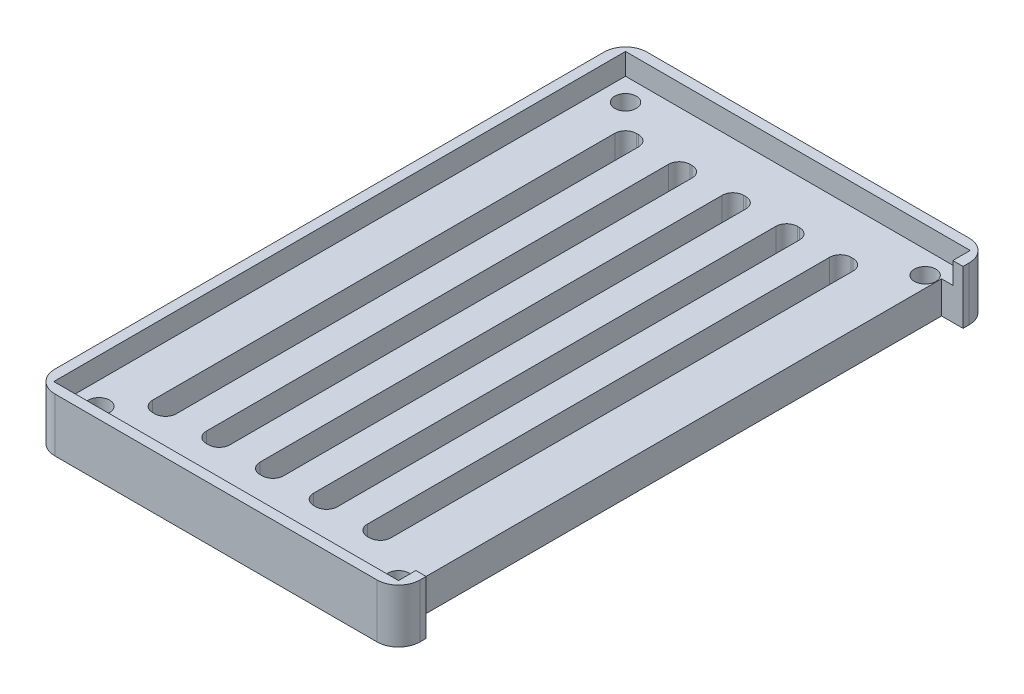
from build123d import *

# Parameters (mm, degrees)
SKETCH_1_W          = 34
SKETCH_1_H          = 55.14
EXTRUDE_1_DEPTH     = 5
SKETCH_2_W          = 32.1
SKETCH_2_H          = 53.24
CUT_EXTRUDE_1_DEPTH = 2
SKETCH_3_W          = 50
SKETCH_3_H          = 10
CUT_EXTRUDE_2_DEPTH = 2
FILLET_3_R          = 2
FILLET_4_R          = 2
FILLET_5_R          = 2
FILLET_6_R          = 2
SKETCH_5_R          = 1
CUT_EXTRUDE_3_DEPTH = 5
CUT_EXTRUDE_5_DEPTH = 5


with BuildPart() as part:
    # 草图1 → 凸台-拉伸1 (new body)
    with BuildSketch(Plane(origin=(0, 0, 0), x_dir=(1, 0, 0), z_dir=(0, 1, 0))):
        with Locations((17, 27.57)):
            Rectangle(SKETCH_1_W, SKETCH_1_H)
    extrude(amount=EXTRUDE_1_DEPTH)

    # 草图2 → 切除-拉伸1 (cut)
    with BuildSketch(Plane(origin=(0, 5, 0), x_dir=(1, 0, 0), z_dir=(0, 1, 0))):
        with Locations((17, 27.57)):
            Rectangle(SKETCH_2_W, SKETCH_2_H)
    extrude(amount=-CUT_EXTRUDE_1_DEPTH, mode=Mode.SUBTRACT)

    # 草图3 → 切除-拉伸2 (cut)
    with BuildSketch(Plane(origin=(34, 0, 0), x_dir=(0, 0, -1), z_dir=(1, 0, 0))):
        with Locations((27.57, 5)):
            Rectangle(SKETCH_3_W, SKETCH_3_H)
    extrude(amount=-CUT_EXTRUDE_2_DEPTH, mode=Mode.SUBTRACT)

    # 圆角3
    fillet_3_edges = [part.edges().sort_by_distance(p)[0] for p in [
        (0, 2.5, 0),
    ]]
    fillet(fillet_3_edges, radius=FILLET_3_R)

    # 圆角4
    fillet_4_edges = [part.edges().sort_by_distance(p)[0] for p in [
        (0, 2.5, -55.14),
    ]]
    fillet(fillet_4_edges, radius=FILLET_4_R)

    # 圆角5
    fillet_5_edges = [part.edges().sort_by_distance(p)[0] for p in [
        (34, 2.5, -55.14),
    ]]
    fillet(fillet_5_edges, radius=FILLET_5_R)

    # 圆角6
    fillet_6_edges = [part.edges().sort_by_distance(p)[0] for p in [
        (34, 2.5, 0),
    ]]
    fillet(fillet_6_edges, radius=FILLET_6_R)

    # 草图5 → 切除-拉伸3 (cut)
    with BuildSketch(Plane(origin=(0, 3, 0), x_dir=(1, 0, 0), z_dir=(0, 1, 0))):
        with Locations(Location((3.05, 52.09, 0), (0, 0, 270))):
            Circle(SKETCH_5_R)
        with Locations(Location((3.05, 3.05, 0), (0, 0, 90))):
            Circle(SKETCH_5_R)
        with Locations(Location((30.95, 3.05, 0), (0, 0, 270))):
            Circle(SKETCH_5_R)
        with Locations(Location((30.95, 52.09, 0), (0, 0, 90))):
            Circle(SKETCH_5_R)
    extrude(amount=-CUT_EXTRUDE_3_DEPTH, mode=Mode.SUBTRACT)

    # 草图6 → 切除-拉伸5 (cut)
    with BuildSketch(Plane(origin=(0, 3, 0), x_dir=(1, 0, 0), z_dir=(0, 1, 0))):
        with BuildLine():
            ThreePointArc((5.05, 49.09), (5.342893219, 49.797106781), (6.05, 50.09))
            Line((6.05, 50.09), (6.254717451, 50.09))
            ThreePointArc((6.254717451, 50.09), (6.961824232, 49.797106781), (7.254717451, 49.09))
            Line((7.254717451, 49.09), (7.254717451, 6.05))
            ThreePointArc((7.254717451, 6.05), (6.961824232, 5.342893219), (6.254717451, 5.05))
            Line((6.254717451, 5.05), (6.05, 5.05))
            ThreePointArc((6.05, 5.05), (5.342893219, 5.342893219), (5.05, 6.05))
            Line((5.05, 6.05), (5.05, 49.09))
        make_face()
        with BuildLine():
            ThreePointArc((10.05, 49.09), (10.342893219, 49.797106781), (11.05, 50.09))
            Line((11.05, 50.09), (11.254717451, 50.09))
            ThreePointArc((11.254717451, 50.09), (11.961824232, 49.797106781), (12.254717451, 49.09))
            Line((12.254717451, 49.09), (12.254717451, 6.05))
            ThreePointArc((12.254717451, 6.05), (11.961824232, 5.342893219), (11.254717451, 5.05))
            Line((11.254717451, 5.05), (11.05, 5.05))
            ThreePointArc((11.05, 5.05), (10.342893219, 5.342893219), (10.05, 6.05))
            Line((10.05, 6.05), (10.05, 49.09))
        make_face()
        with BuildLine():
            ThreePointArc((20.05, 49.09), (20.342893219, 49.797106781), (21.05, 50.09))
            Line((21.05, 50.09), (21.254717451, 50.09))
            ThreePointArc((21.254717451, 50.09), (21.961824232, 49.797106781), (22.254717451, 49.09))
            Line((22.254717451, 49.09), (22.254717451, 6.05))
            ThreePointArc((22.254717451, 6.05), (21.961824232, 5.342893219), (21.254717451, 5.05))
            Line((21.254717451, 5.05), (21.05, 5.05))
            ThreePointArc((21.05, 5.05), (20.342893219, 5.342893219), (20.05, 6.05))
            Line((20.05, 6.05), (20.05, 49.09))
        make_face()
        with BuildLine():
            ThreePointArc((26.05, 5.05), (25.342893219, 5.342893219), (25.05, 6.05))
            Line((25.05, 6.05), (25.05, 49.09))
            ThreePointArc((25.05, 49.09), (25.342893219, 49.797106781), (26.05, 50.09))
            Line((26.05, 50.09), (26.254717451, 50.09))
            ThreePointArc((26.254717451, 50.09), (26.961824232, 49.797106781), (27.254717451, 49.09))
            Line((27.254717451, 49.09), (27.254717451, 6.05))
            ThreePointArc((27.254717451, 6.05), (26.961824232, 5.342893219), (26.254717451, 5.05))
            Line((26.254717451, 5.05), (26.05, 5.05))
        make_face()
        with BuildLine():
            Line((15.05, 49.09), (15.05, 6.05))
            ThreePointArc((15.05, 6.05), (15.342893219, 5.342893219), (16.05, 5.05))
            Line((16.05, 5.05), (16.254717451, 5.05))
            ThreePointArc((16.254717451, 5.05), (16.961824232, 5.342893219), (17.254717451, 6.05))
            Line((17.254717451, 6.05), (17.254717451, 49.09))
            ThreePointArc((17.254717451, 49.09), (16.961824232, 49.797106781), (16.254717451, 50.09))
            Line((16.254717451, 50.09), (16.05, 50.09))
            ThreePointArc((16.05, 50.09), (15.342893219, 49.797106781), (15.05, 49.09))
        make_face()
    extrude(amount=-CUT_EXTRUDE_5_DEPTH, mode=Mode.SUBTRACT)


solid = part.part
